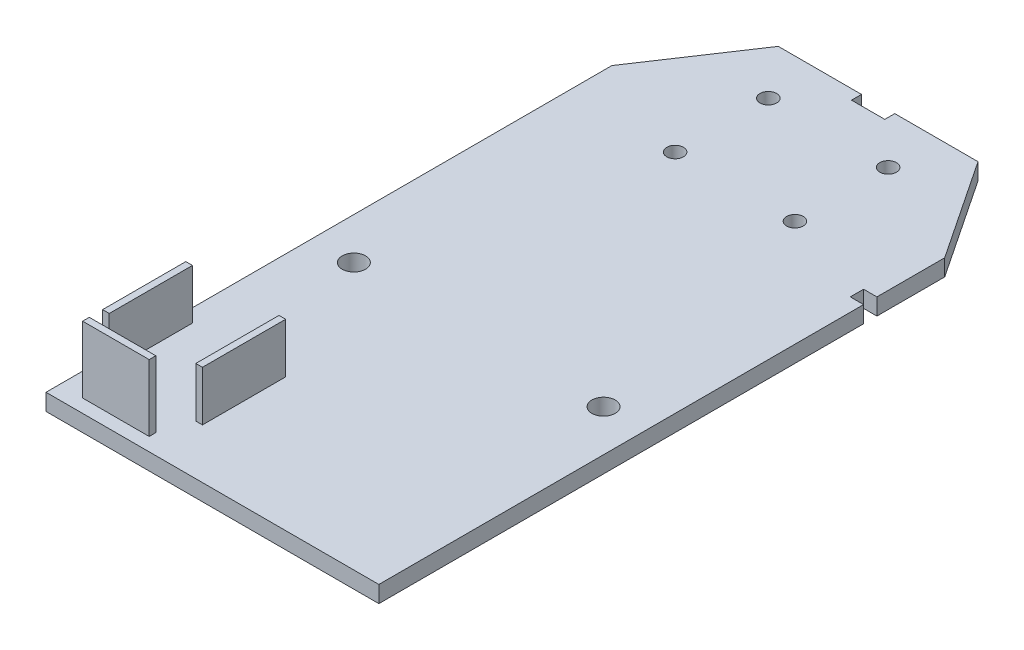
from build123d import *

# Parameters (mm, degrees)
CROQUIS1_W              = 100
CROQUIS1_H              = 200
SALIENTE_EXTRUIR3_DEPTH = 5
CROQUIS5_R              = 2.5
CORTAR_EXTRUIR1_DEPTH   = 224.662692463
CROQUIS11_R             = 3.5
CORTAR_EXTRUIR5_DEPTH   = 224.662692463
CROQUIS12_W             = 10
CROQUIS12_H             = 3
CORTAR_EXTRUIR6_DEPTH   = 224.662692463
CORTAR_EXTRUIR7_DEPTH   = 224.662692463
CROQUIS15_W             = 4
CROQUIS15_H             = 4
CORTAR_EXTRUIR9_DEPTH   = 224.662692463
CROQUIS16_W             = 20
CROQUIS16_H             = 2
SALIENTE_EXTRUIR6_DEPTH = 20
CROQUIS17_W             = 2
CROQUIS17_H             = 25
SALIENTE_EXTRUIR7_DEPTH = 15


with BuildPart() as part:
    # Croquis1 → Saliente-Extruir3 (new body)
    with BuildSketch(Plane(origin=(0, 0, 0), x_dir=(1, 0, 0), z_dir=(0, 1, 0))):
        with Locations((50, 100)):
            Rectangle(CROQUIS1_W, CROQUIS1_H)
    extrude(amount=SALIENTE_EXTRUIR3_DEPTH)

    # Croquis5 → Cortar-Extruir1 (cut, through all)
    with BuildSketch(Plane(origin=(0, 5, 0), x_dir=(1, 0, 0), z_dir=(0, 1, 0))):
        with Locations(Location((32, 185, 0), (0, 0, 270))):
            Circle(CROQUIS5_R)
        with Locations(Location((68, 185, 0), (0, 0, 270))):
            Circle(CROQUIS5_R)
        with Locations(Location((32, 157, 0), (0, 0, 270))):
            Circle(CROQUIS5_R)
        with Locations(Location((68, 157, 0), (0, 0, 270))):
            Circle(CROQUIS5_R)
    extrude(amount=-CORTAR_EXTRUIR1_DEPTH, mode=Mode.SUBTRACT)

    # Croquis11 → Cortar-Extruir5 (cut, through all)
    with BuildSketch(Plane(origin=(0, 5, 0), x_dir=(1, 0, 0), z_dir=(0, 1, 0))):
        with Locations(Location((12.5, 80, 0), (0, 0, 270))):
            Circle(CROQUIS11_R)
        with Locations(Location((87.5, 80, 0), (0, 0, 270))):
            Circle(CROQUIS11_R)
    extrude(amount=-CORTAR_EXTRUIR5_DEPTH, mode=Mode.SUBTRACT)

    # Croquis12 → Cortar-Extruir6 (cut, through all)
    with BuildSketch(Plane(origin=(0, 5, 0), x_dir=(1, 0, 0), z_dir=(0, 1, 0))):
        with Locations((50, 198.5)):
            Rectangle(CROQUIS12_W, CROQUIS12_H)
    extrude(amount=-CORTAR_EXTRUIR6_DEPTH, mode=Mode.SUBTRACT)

    # Croquis13 → Cortar-Extruir7 (cut, through all)
    with BuildSketch(Plane(origin=(0, 5, 0), x_dir=(1, 0, 0), z_dir=(0, 1, 0))):
        Polygon((0, 170), (20, 200), (0, 200), align=None)
        Polygon((100, 170), (80, 200), (100, 200), align=None)
    extrude(amount=-CORTAR_EXTRUIR7_DEPTH, mode=Mode.SUBTRACT)

    # Croquis15 → Cortar-Extruir9 (cut, through all)
    with BuildSketch(Plane(origin=(0, 5, 0), x_dir=(1, 0, 0), z_dir=(0, 1, 0))):
        with Locations((98, 147.627138927)):
            Rectangle(CROQUIS15_W, CROQUIS15_H)
    extrude(amount=-CORTAR_EXTRUIR9_DEPTH, mode=Mode.SUBTRACT)

    # Croquis17 → Saliente-Extruir7 (add)
    with BuildSketch(Plane(origin=(0, 5, 0), x_dir=(1, 0, 0), z_dir=(0, 1, 0))):
        with Locations((31, 27.5)):
            Rectangle(CROQUIS17_W, CROQUIS17_H)
        with Locations((3, 27.5)):
            Rectangle(CROQUIS17_W, CROQUIS17_H)
    extrude(amount=SALIENTE_EXTRUIR7_DEPTH)


with BuildPart() as body_2:
    # Croquis16 → Saliente-Extruir6 (new body)
    with BuildSketch(Plane(origin=(0, 5, 0), x_dir=(1, 0, 0), z_dir=(0, 1, 0))):
        with Locations((17, 5)):
            Rectangle(CROQUIS16_W, CROQUIS16_H)
    extrude(amount=SALIENTE_EXTRUIR6_DEPTH)


solid = Compound([part.part, body_2.part])
